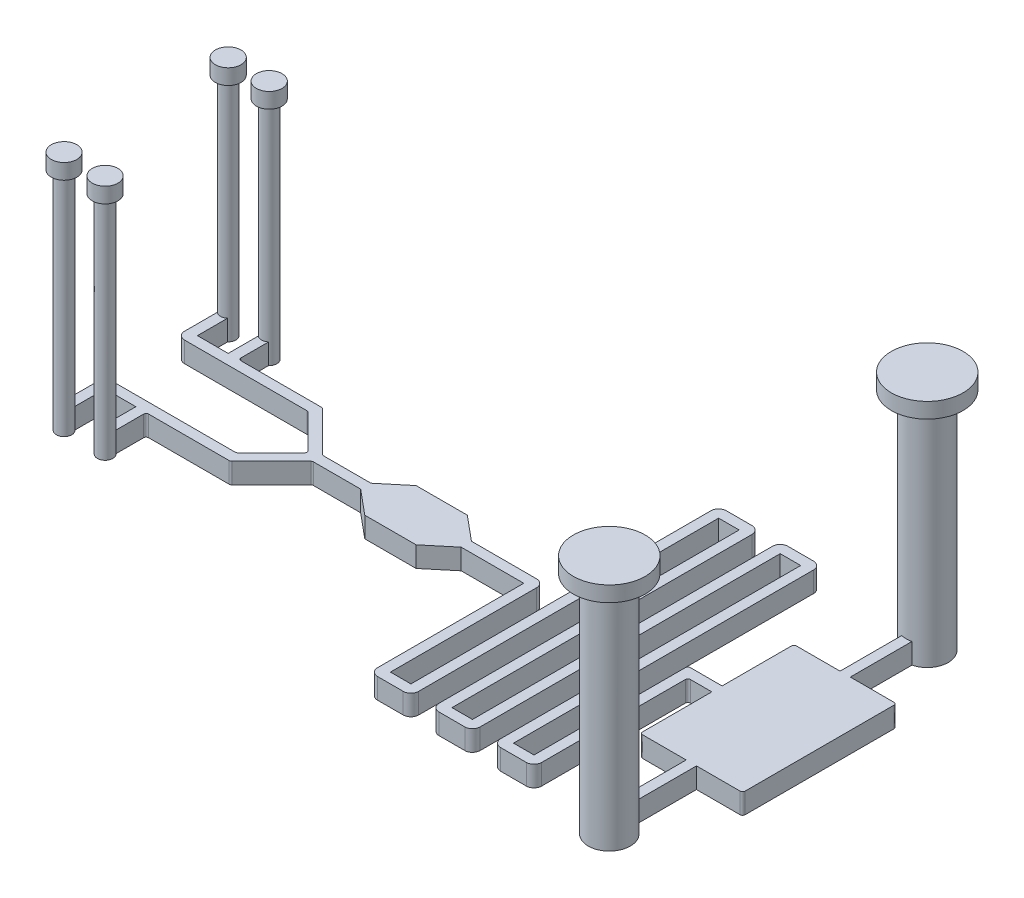
from build123d import *

# Parameters (mm, degrees)
SKELTON_BASE_DEPTH = 2
SKETCH3_R          = 2.05
SKETCH3_R_2        = 0.75
SUPPORT_LEG_DEPTH  = 20
SKETCH5_R          = 3.5
SKETCH5_R_2        = 1.25
SKETCH5_R_3        = 1.247534176
SUPPORT_HEAD_DEPTH = 1.5


with BuildPart() as part:
    # skelton_drawing → Skelton_base (new body)
    with BuildSketch(Plane(origin=(0, 0, 0), x_dir=(1, 0, 0), z_dir=(0, 1, 0))):
        with BuildLine():
            Line((15.163755459, 7.25), (15.163755459, -7.25))
            ThreePointArc((15.163755459, -7.25), (15.090532154, -7.426776695), (14.913755459, -7.5))
            Line((14.913755459, -7.5), (10.663755459, -7.5))
            Line((10.663755459, -7.5), (10.663755459, -13.511910465))
            ThreePointArc((10.663755459, -13.511910465), (10.163755459, -17.55), (9.663755459, -13.511910465))
            Line((9.663755459, -13.511910465), (9.663755459, -7.5))
            Line((9.663755459, -7.5), (5.413755459, -7.5))
            ThreePointArc((5.413755459, -7.5), (5.236978763, -7.426776695), (5.163755459, -7.25))
            Line((5.163755459, -7.25), (5.163755459, -0.5))
            Line((5.163755459, -0.5), (3.075114856, -0.5))
            ThreePointArc((3.075114856, -0.5), (2.898338161, -0.573223305), (2.825114856, -0.75))
            Line((2.825114856, -0.75), (2.825114856, -14.75))
            ThreePointArc((2.825114856, -14.75), (2.605444942, -15.280330086), (2.075114856, -15.5))
            Line((2.075114856, -15.5), (-0.424885144, -15.5))
            ThreePointArc((-0.424885144, -15.5), (-0.95521523, -15.280330086), (-1.174885144, -14.75))
            Line((-1.174885144, -14.75), (-1.174885144, 14.5))
            Line((-1.174885144, 14.5), (-3.174885144, 14.5))
            Line((-3.174885144, 14.5), (-3.174885144, -14.75))
            ThreePointArc((-3.174885144, -14.75), (-3.394555058, -15.280330086), (-3.924885144, -15.5))
            Line((-3.924885144, -15.5), (-6.424885144, -15.5))
            ThreePointArc((-6.424885144, -15.5), (-6.95521523, -15.280330086), (-7.174885144, -14.75))
            Line((-7.174885144, -14.75), (-7.174885144, 14.5))
            Line((-7.174885144, 14.5), (-9.174885144, 14.5))
            Line((-9.174885144, 14.5), (-9.174885144, -14.75))
            ThreePointArc((-9.174885144, -14.75), (-9.394555058, -15.280330086), (-9.924885144, -15.5))
            Line((-9.924885144, -15.5), (-12.424885144, -15.5))
            ThreePointArc((-12.424885144, -15.5), (-12.95521523, -15.280330086), (-13.174885144, -14.75))
            Line((-13.174885144, -14.75), (-13.174885144, -0.5))
            Line((-13.174885144, -0.5), (-19.274885144, -0.5))
            Line((-19.274885144, -0.5), (-21.674885144, -2.5))
            Line((-21.674885144, -2.5), (-26.674885144, -2.5))
            Line((-26.674885144, -2.5), (-29.074885144, -0.5))
            Line((-29.074885144, -0.5), (-33.68175141, -0.5))
            ThreePointArc((-33.68175141, -0.5), (-33.777422268, -0.519030117), (-33.858528105, -0.573223305))
            Line((-33.858528105, -0.573223305), (-37.712081496, -4.426776695))
            ThreePointArc((-37.712081496, -4.426776695), (-37.793187333, -4.480969883), (-37.888858191, -4.5))
            Line((-37.888858191, -4.5), (-45.742411582, -4.5))
            ThreePointArc((-45.742411582, -4.5), (-45.919188277, -4.573223305), (-45.992411582, -4.75))
            Line((-45.992411582, -4.75), (-45.992411582, -7.440983006))
            ThreePointArc((-45.992411582, -7.440983006), (-46.492411582, -8.75), (-46.992411582, -7.440983006))
            Line((-46.992411582, -7.440983006), (-46.992411582, -4.5))
            Line((-46.992411582, -4.5), (-49.992411582, -4.5))
            Line((-49.992411582, -4.5), (-49.992411582, -7.440983006))
            ThreePointArc((-49.992411582, -7.440983006), (-50.492411582, -8.75), (-50.992411582, -7.440983006))
            Line((-50.992411582, -7.440983006), (-50.992411582, -4.25))
            ThreePointArc((-50.992411582, -4.25), (-50.772741668, -3.719669914), (-50.242411582, -3.5))
            Line((-50.242411582, -3.5), (-38.303071753, -3.5))
            ThreePointArc((-38.303071753, -3.5), (-38.207400895, -3.480969883), (-38.126295058, -3.426776695))
            Line((-38.126295058, -3.426776695), (-34.876295058, -0.176776695))
            ThreePointArc((-34.876295058, -0.176776695), (-34.803071753, 0), (-34.876295058, 0.176776695))
            Line((-34.876295058, 0.176776695), (-38.126295058, 3.426776695))
            ThreePointArc((-38.126295058, 3.426776695), (-38.207400895, 3.480969883), (-38.303071753, 3.5))
            Line((-38.303071753, 3.5), (-46.242411582, 3.5))
            Line((-46.242411582, 3.5), (-50.242411582, 3.5))
            ThreePointArc((-50.242411582, 3.5), (-50.772741668, 3.719669914), (-50.992411582, 4.25))
            Line((-50.992411582, 4.25), (-50.992411582, 7.440983006))
            ThreePointArc((-50.992411582, 7.440983006), (-50.492411582, 8.75), (-49.992411582, 7.440983006))
            Line((-49.992411582, 7.440983006), (-49.992411582, 4.5))
            Line((-49.992411582, 4.5), (-46.992411582, 4.5))
            Line((-46.992411582, 4.5), (-46.992411582, 7.440983006))
            ThreePointArc((-46.992411582, 7.440983006), (-46.492411582, 8.75), (-45.992411582, 7.440983006))
            Line((-45.992411582, 7.440983006), (-45.992411582, 4.75))
            ThreePointArc((-45.992411582, 4.75), (-45.919188277, 4.573223305), (-45.742411582, 4.5))
            Line((-45.742411582, 4.5), (-37.888858191, 4.5))
            ThreePointArc((-37.888858191, 4.5), (-37.793187333, 4.480969883), (-37.712081496, 4.426776695))
            Line((-37.712081496, 4.426776695), (-33.858528105, 0.573223305))
            ThreePointArc((-33.858528105, 0.573223305), (-33.777422268, 0.519030117), (-33.68175141, 0.5))
            Line((-33.68175141, 0.5), (-29.074885144, 0.5))
            Line((-29.074885144, 0.5), (-26.674885144, 2.5))
            Line((-26.674885144, 2.5), (-21.674885144, 2.5))
            Line((-21.674885144, 2.5), (-19.274885144, 0.5))
            Line((-19.274885144, 0.5), (-12.924885144, 0.5))
            ThreePointArc((-12.924885144, 0.5), (-12.394555058, 0.280330086), (-12.174885144, -0.25))
            Line((-12.174885144, -0.25), (-12.174885144, -14.5))
            Line((-12.174885144, -14.5), (-10.174885144, -14.5))
            Line((-10.174885144, -14.5), (-10.174885144, 14.75))
            ThreePointArc((-10.174885144, 14.75), (-9.95521523, 15.280330086), (-9.424885144, 15.5))
            Line((-9.424885144, 15.5), (-6.924885144, 15.5))
            ThreePointArc((-6.924885144, 15.5), (-6.394555058, 15.280330086), (-6.174885144, 14.75))
            Line((-6.174885144, 14.75), (-6.174885144, -14.5))
            Line((-6.174885144, -14.5), (-4.174885144, -14.5))
            Line((-4.174885144, -14.5), (-4.174885144, 14.75))
            ThreePointArc((-4.174885144, 14.75), (-3.95521523, 15.280330086), (-3.424885144, 15.5))
            Line((-3.424885144, 15.5), (-0.924885144, 15.5))
            ThreePointArc((-0.924885144, 15.5), (-0.394555058, 15.280330086), (-0.174885144, 14.75))
            Line((-0.174885144, 14.75), (-0.174885144, -14.5))
            Line((-0.174885144, -14.5), (1.825114856, -14.5))
            Line((1.825114856, -14.5), (1.825114856, 0.25))
            ThreePointArc((1.825114856, 0.25), (1.898338161, 0.426776695), (2.075114856, 0.5))
            Line((2.075114856, 0.5), (5.163755459, 0.5))
            Line((5.163755459, 0.5), (5.163755459, 7.25))
            ThreePointArc((5.163755459, 7.25), (5.236978763, 7.426776695), (5.413755459, 7.5))
            Line((5.413755459, 7.5), (9.663755459, 7.5))
            Line((9.663755459, 7.5), (9.663755459, 13.511910465))
            ThreePointArc((9.663755459, 13.511910465), (10.163755459, 17.55), (10.663755459, 13.511910465))
            Line((10.663755459, 13.511910465), (10.663755459, 7.5))
            Line((10.663755459, 7.5), (14.913755459, 7.5))
            ThreePointArc((14.913755459, 7.5), (15.090532154, 7.426776695), (15.163755459, 7.25))
        make_face()
    extrude(amount=SKELTON_BASE_DEPTH)

    # Sketch3 → Support_leg (add)
    with BuildSketch(Plane(origin=(0, 2, 0), x_dir=(1, 0, 0), z_dir=(0, 1, 0))):
        with Locations(Location((10.163755459, 15.5, 0), (0, 0, 255.883019429))):
            Circle(SKETCH3_R)
        with Locations(Location((10.163755459, -15.5, 0), (0, 0, 75.883019429))):
            Circle(SKETCH3_R)
        with Locations(Location((-46.492411582, 8, 0), (0, 0, 228.189685104))):
            Circle(SKETCH3_R_2)
        with Locations(Location((-50.492411582, 8, 0), (0, 0, 311.810314896))):
            Circle(SKETCH3_R_2)
        with Locations(Location((-46.492411582, -8, 0), (0, 0, 48.189685104))):
            Circle(SKETCH3_R_2)
        with Locations(Location((-50.492411582, -8, 0), (0, 0, 48.189685104))):
            Circle(SKETCH3_R_2)
    extrude(amount=SUPPORT_LEG_DEPTH)

    # Sketch5 → Support_head (add)
    with BuildSketch(Plane(origin=(0, 22, 0), x_dir=(1, 0, 0), z_dir=(0, 1, 0))):
        with Locations(Location((10.163755459, -15.5, 0), (0, 0, 270))):
            Circle(SKETCH5_R)
        with Locations(Location((10.163755459, 15.5, 0), (0, 0, 270))):
            Circle(SKETCH5_R)
        with Locations(Location((-46.492411582, 8, 0), (0, 0, 270))):
            Circle(SKETCH5_R_2)
        with Locations(Location((-50.492411582, 8, 0), (0, 0, 270))):
            Circle(SKETCH5_R_2)
        with Locations(Location((-46.492411582, -8, 0), (0, 0, 270))):
            Circle(SKETCH5_R_2)
        with Locations(Location((-50.492411582, -8, 0), (0, 0, 270))):
            Circle(SKETCH5_R_3)
    extrude(amount=SUPPORT_HEAD_DEPTH)


solid = part.part
